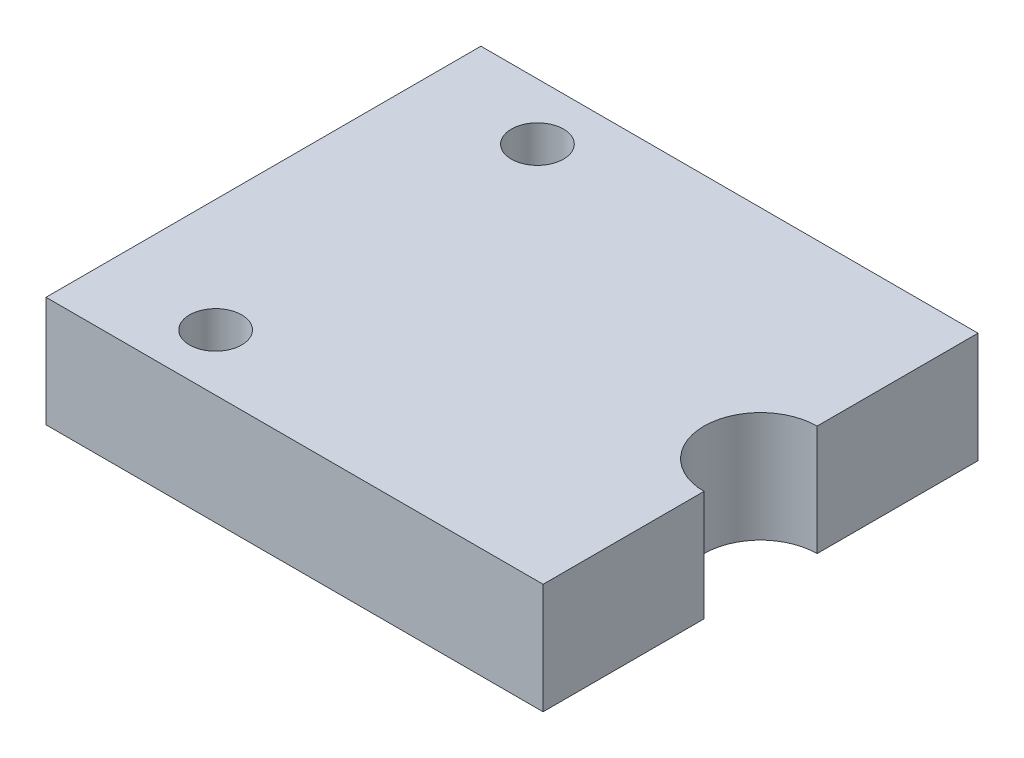
from build123d import *

# Parameters (mm, degrees)
CROQUIS2_R              = 3
SALIENTE_EXTRUIR1_DEPTH = 12.7


with BuildPart() as part:
    # Croquis2 → Saliente-Extruir1 (new body)
    with BuildSketch(Plane(origin=(0, 0, 0), x_dir=(1, 0, 0), z_dir=(0, 1, 0))):
        with BuildLine():
            Line((0, 25), (-57.15, 25))
            Line((-57.15, 25), (-57.15, -25))
            Line((-57.15, -25), (0, -25))
            Line((0, -25), (0, -6.5))
            ThreePointArc((0, -6.5), (-6.5, 0), (0, 6.5))
            Line((0, 6.5), (0, 25))
        make_face()
        with Locations(Location((-44.15, -18.5, 0), (0, 0, 270))):
            Circle(CROQUIS2_R, mode=Mode.SUBTRACT)
        with Locations(Location((-44.15, 18.5, 0), (0, 0, 270))):
            Circle(CROQUIS2_R, mode=Mode.SUBTRACT)
    extrude(amount=SALIENTE_EXTRUIR1_DEPTH)


solid = part.part
